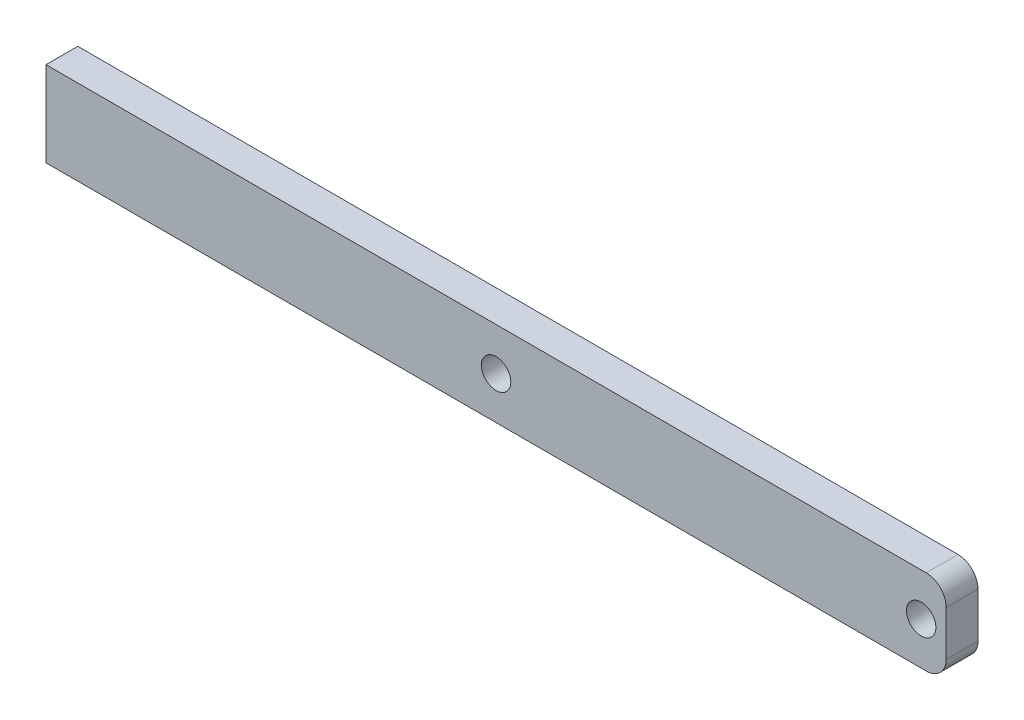
from build123d import *

# Parameters (mm, degrees)
SKETCH1_W           = 90
SKETCH1_H           = 8.5
SKETCH1_R           = 1.47
BOSS_EXTRUDE1_DEPTH = 3.18
SKETCH2_R           = 1.47
CUT_EXTRUDE1_DEPTH  = 91.456411602
FILLET1_R           = 2


with BuildPart() as part:
    # Sketch1 → Boss-Extrude1 (new body)
    with BuildSketch(Plane.XY):
        with Locations((45, 4.25)):
            Rectangle(SKETCH1_W, SKETCH1_H)
        with Locations(Location((87.5, 4.25, 0), (0, 0, 180))):
            Circle(SKETCH1_R, mode=Mode.SUBTRACT)
    extrude(amount=BOSS_EXTRUDE1_DEPTH)

    # Sketch2 → Cut-Extrude1 (cut, through all)
    with BuildSketch(Plane.XY.offset(3.18)):
        with Locations((45, 4.25)):
            Circle(SKETCH2_R)
    extrude(amount=-CUT_EXTRUDE1_DEPTH, mode=Mode.SUBTRACT)

    # Fillet1
    fillet1_edges = [part.edges().sort_by_distance(p)[0] for p in [
        (90, 8.5, 1.59),
        (90, 0, 1.59),
    ]]
    fillet(fillet1_edges, radius=FILLET1_R)


solid = part.part
